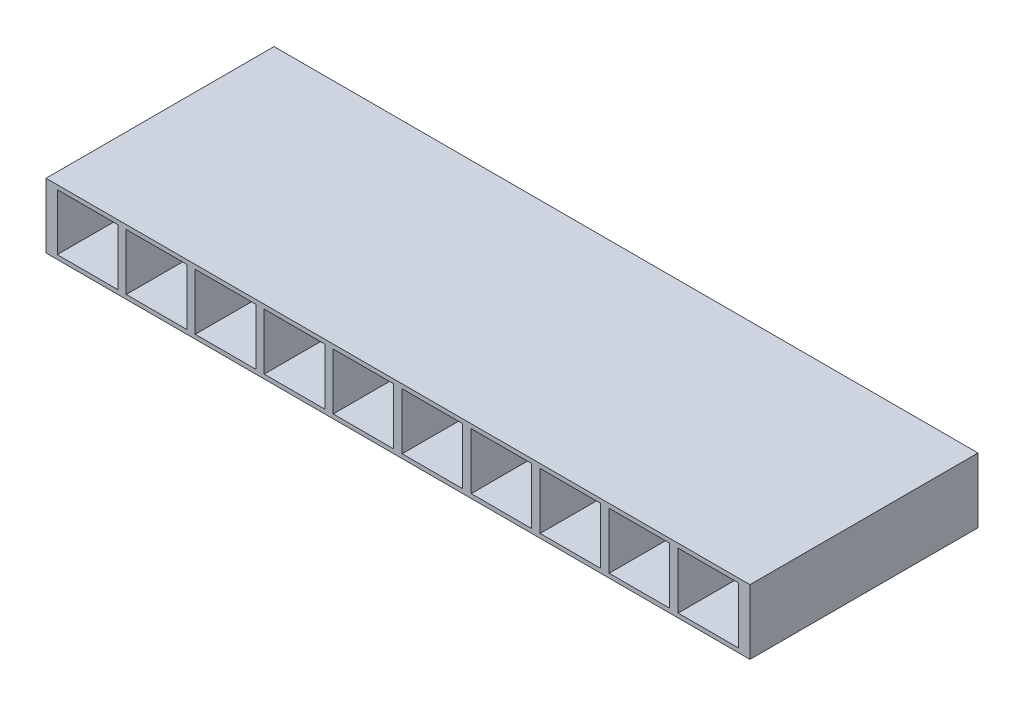
from build123d import *

# Parameters (mm, degrees)
ESQUISSE1_W        = 25
ESQUISSE1_H        = 2.3
ESQUISSE1_W_2      = 2.15
ESQUISSE1_H_2      = 2
BOSS_EXTRU_3_DEPTH = 8.1


with BuildPart() as part:
    # Esquisse1 → Boss.-Extru.3 (new body)
    with BuildSketch(Plane.XY):
        Rectangle(ESQUISSE1_W, ESQUISSE1_H)
        with Locations((-8.575, 0)):
            Rectangle(ESQUISSE1_W_2, ESQUISSE1_H_2, mode=Mode.SUBTRACT)
        with Locations((-11.025, 0)):
            Rectangle(ESQUISSE1_W_2, ESQUISSE1_H_2, mode=Mode.SUBTRACT)
        with Locations((-6.125, 0)):
            Rectangle(ESQUISSE1_W_2, ESQUISSE1_H_2, mode=Mode.SUBTRACT)
        with Locations((-3.675, 0)):
            Rectangle(ESQUISSE1_W_2, ESQUISSE1_H_2, mode=Mode.SUBTRACT)
        with Locations((-1.225, 0)):
            Rectangle(ESQUISSE1_W_2, ESQUISSE1_H_2, mode=Mode.SUBTRACT)
        with Locations((1.225, 0)):
            Rectangle(ESQUISSE1_W_2, ESQUISSE1_H_2, mode=Mode.SUBTRACT)
        with Locations((3.675, 0)):
            Rectangle(ESQUISSE1_W_2, ESQUISSE1_H_2, mode=Mode.SUBTRACT)
        with Locations((6.125, 0)):
            Rectangle(ESQUISSE1_W_2, ESQUISSE1_H_2, mode=Mode.SUBTRACT)
        with Locations((8.575, 0)):
            Rectangle(ESQUISSE1_W_2, ESQUISSE1_H_2, mode=Mode.SUBTRACT)
        with Locations((11.025, 0)):
            Rectangle(ESQUISSE1_W_2, ESQUISSE1_H_2, mode=Mode.SUBTRACT)
    extrude(amount=BOSS_EXTRU_3_DEPTH)


solid = part.part
